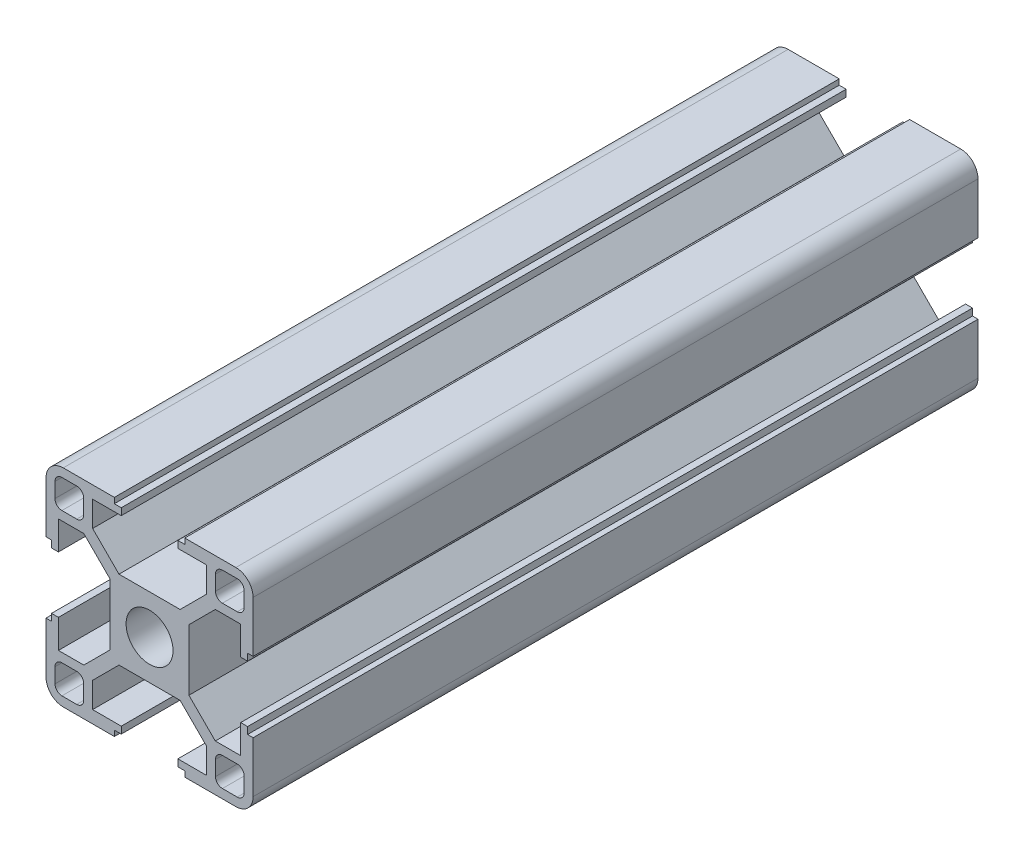
from build123d import *

# Parameters (mm, degrees)
SKETCH1_R      = 3.4
EXTRUDE1_DEPTH = 105
EXTRUDE2_DEPTH = 108.121426428


with BuildPart() as part:
    # Sketch1 → Extrude1 (new body)
    with BuildSketch(Plane.XY):
        with BuildLine():
            Line((-5.1, 14.2), (-5.1, 15))
            Line((-5.1, 15), (-12.5, 15))
            ThreePointArc((-12.5, 15), (-14.267766953, 14.267766953), (-15, 12.5))
            Line((-15, 12.5), (-15, 5.1))
            Line((-15, 5.1), (-14.2, 5.1))
            Line((-14.2, 5.1), (-14.2, 4.1))
            Line((-14.2, 4.1), (-13.2, 4.1))
            Line((-13.2, 4.1), (-13.2, 8.25))
            Line((-13.2, 8.25), (-9.522792206, 8.25))
            Line((-9.522792206, 8.25), (-5.7, 4.427207794))
            Line((-5.7, 4.427207794), (-5.7, -4.427207794))
            Line((-5.7, -4.427207794), (-9.522792206, -8.25))
            Line((-9.522792206, -8.25), (-13.2, -8.25))
            Line((-13.2, -8.25), (-13.2, -4.1))
            Line((-13.2, -4.1), (-14.2, -4.1))
            Line((-14.2, -4.1), (-14.2, -5.1))
            Line((-14.2, -5.1), (-15, -5.1))
            Line((-15, -5.1), (-15, -12.5))
            ThreePointArc((-15, -12.5), (-14.267766953, -14.267766953), (-12.5, -15))
            Line((-12.5, -15), (-5.1, -15))
            Line((-5.1, -15), (-5.1, -14.2))
            Line((-5.1, -14.2), (-4.1, -14.2))
            Line((-4.1, -14.2), (-4.1, -13.2))
            Line((-4.1, -13.2), (-8.25, -13.2))
            Line((-8.25, -13.2), (-8.25, -9.522792206))
            Line((-8.25, -9.522792206), (-4.427207794, -5.7))
            Line((-4.427207794, -5.7), (4.427207794, -5.7))
            Line((4.427207794, -5.7), (8.25, -9.522792206))
            Line((8.25, -9.522792206), (8.25, -13.2))
            Line((8.25, -13.2), (4.1, -13.2))
            Line((4.1, -13.2), (4.1, -14.2))
            Line((4.1, -14.2), (5.1, -14.2))
            Line((5.1, -14.2), (5.1, -15))
            Line((5.1, -15), (12.5, -15))
            ThreePointArc((12.5, -15), (14.267766953, -14.267766953), (15, -12.5))
            Line((15, -12.5), (15, -5.1))
            Line((15, -5.1), (14.2, -5.1))
            Line((14.2, -5.1), (14.2, -4.1))
            Line((14.2, -4.1), (13.2, -4.1))
            Line((13.2, -4.1), (13.2, -8.25))
            Line((13.2, -8.25), (9.522792206, -8.25))
            Line((9.522792206, -8.25), (5.7, -4.427207794))
            Line((5.7, -4.427207794), (5.7, 4.427207794))
            Line((5.7, 4.427207794), (9.522792206, 8.25))
            Line((9.522792206, 8.25), (13.2, 8.25))
            Line((13.2, 8.25), (13.2, 4.1))
            Line((13.2, 4.1), (14.2, 4.1))
            Line((14.2, 4.1), (14.2, 5.1))
            Line((14.2, 5.1), (15, 5.1))
            Line((15, 5.1), (15, 12.5))
            ThreePointArc((15, 12.5), (14.267766953, 14.267766953), (12.5, 15))
            Line((12.5, 15), (5.1, 15))
            Line((5.1, 15), (5.1, 14.2))
            Line((5.1, 14.2), (4.1, 14.2))
            Line((4.1, 14.2), (4.1, 13.2))
            Line((4.1, 13.2), (8.25, 13.2))
            Line((8.25, 13.2), (8.25, 9.522792206))
            Line((8.25, 9.522792206), (4.427207794, 5.7))
            Line((4.427207794, 5.7), (-4.427207794, 5.7))
            Line((-4.427207794, 5.7), (-8.25, 9.522792206))
            Line((-8.25, 9.522792206), (-8.25, 13.2))
            Line((-8.25, 13.2), (-4.1, 13.2))
            Line((-4.1, 13.2), (-4.1, 14.2))
            Line((-4.1, 14.2), (-5.1, 14.2))
        make_face()
        Circle(SKETCH1_R, mode=Mode.SUBTRACT)
    extrude(amount=EXTRUDE1_DEPTH)

    # Sketch2 → Extrude2 (cut, through all)
    with BuildSketch(Plane.XY.offset(105)):
        with BuildLine():
            Line((13.7, 12.7), (13.7, 10.55))
            ThreePointArc((13.7, 10.55), (13.407106781, 9.842893219), (12.7, 9.55))
            Line((12.7, 9.55), (10.55, 9.55))
            ThreePointArc((10.55, 9.55), (9.842893219, 9.842893219), (9.55, 10.55))
            Line((9.55, 10.55), (9.55, 12.7))
            ThreePointArc((9.55, 12.7), (9.842893219, 13.407106781), (10.55, 13.7))
            Line((10.55, 13.7), (12.7, 13.7))
            ThreePointArc((12.7, 13.7), (13.407106781, 13.407106781), (13.7, 12.7))
        make_face()
        with BuildLine():
            Line((-12.7, 13.7), (-10.55, 13.7))
            ThreePointArc((-10.55, 13.7), (-9.842893219, 13.407106781), (-9.55, 12.7))
            Line((-9.55, 12.7), (-9.55, 10.55))
            ThreePointArc((-9.55, 10.55), (-9.842893219, 9.842893219), (-10.55, 9.55))
            Line((-10.55, 9.55), (-12.7, 9.55))
            ThreePointArc((-12.7, 9.55), (-13.407106781, 9.842893219), (-13.7, 10.55))
            Line((-13.7, 10.55), (-13.7, 12.7))
            ThreePointArc((-13.7, 12.7), (-13.407106781, 13.407106781), (-12.7, 13.7))
        make_face()
        with BuildLine():
            Line((12.7, -13.7), (10.55, -13.7))
            ThreePointArc((10.55, -13.7), (9.842893219, -13.407106781), (9.55, -12.7))
            Line((9.55, -12.7), (9.55, -10.55))
            ThreePointArc((9.55, -10.55), (9.842893219, -9.842893219), (10.55, -9.55))
            Line((10.55, -9.55), (12.7, -9.55))
            ThreePointArc((12.7, -9.55), (13.407106781, -9.842893219), (13.7, -10.55))
            Line((13.7, -10.55), (13.7, -12.7))
            ThreePointArc((13.7, -12.7), (13.407106781, -13.407106781), (12.7, -13.7))
        make_face()
        with BuildLine():
            Line((-13.7, -12.7), (-13.7, -10.55))
            ThreePointArc((-13.7, -10.55), (-13.407106781, -9.842893219), (-12.7, -9.55))
            Line((-12.7, -9.55), (-10.55, -9.55))
            ThreePointArc((-10.55, -9.55), (-9.842893219, -9.842893219), (-9.55, -10.55))
            Line((-9.55, -10.55), (-9.55, -12.7))
            ThreePointArc((-9.55, -12.7), (-9.842893219, -13.407106781), (-10.55, -13.7))
            Line((-10.55, -13.7), (-12.7, -13.7))
            ThreePointArc((-12.7, -13.7), (-13.407106781, -13.407106781), (-13.7, -12.7))
        make_face()
    extrude(amount=-EXTRUDE2_DEPTH, mode=Mode.SUBTRACT)


solid = part.part
